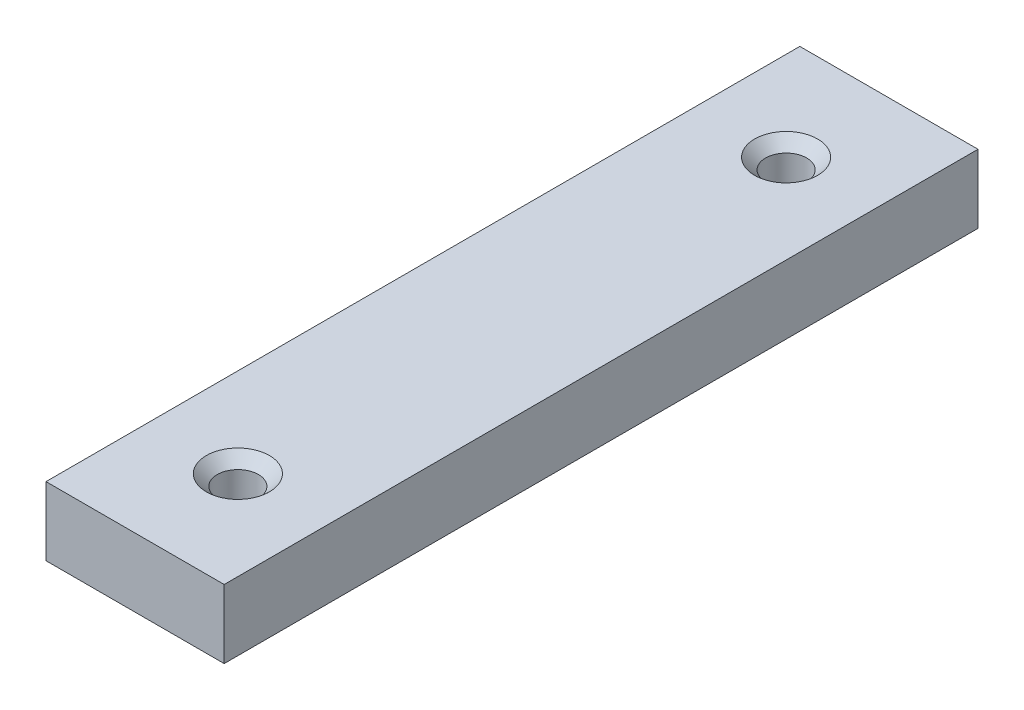
from build123d import *

# Parameters (mm, degrees)
SKETCH_2_W          = 26
SKETCH_2_H          = 110
EXTRUDE_1_DEPTH     = 5
CUT_EXTRUDE_1_REACH = 59.393
SKETCH_3_R          = 3
CHAMFER_1_SIZE      = 1.6


with BuildPart() as part:
    # Эскиз2 → Бобышка-Вытянуть1 (new, symmetric)
    with BuildSketch(Plane(origin=(0, 0, 0), x_dir=(1, 0, 0), z_dir=(0, 1, 0))):
        Rectangle(SKETCH_2_W, SKETCH_2_H)
    extrude(amount=EXTRUDE_1_DEPTH, both=True)

    # Эскиз3 → Вырез-Вытянуть1 (cut, up to next)
    with BuildSketch(Plane(origin=(0, 5, 0), x_dir=(1, 0, 0), z_dir=(0, 1, 0)), mode=Mode.PRIVATE) as cut_extrude_1_sk1:
        with Locations(Location((0, 40, 0), (0, 0, 270))):
            Circle(SKETCH_3_R)
    cut_extrude_1_tool1 = extrude(cut_extrude_1_sk1.sketch, amount=-CUT_EXTRUDE_1_REACH, mode=Mode.PRIVATE) & part.part
    # Эскиз3 → Вырез-Вытянуть1 (cut, up to next)
    with BuildSketch(Plane(origin=(0, 5, 0), x_dir=(1, 0, 0), z_dir=(0, 1, 0)), mode=Mode.PRIVATE) as cut_extrude_1_sk2:
        with Locations(Location((0, -40, 0), (0, 0, 270))):
            Circle(SKETCH_3_R)
    cut_extrude_1_tool2 = extrude(cut_extrude_1_sk2.sketch, amount=-CUT_EXTRUDE_1_REACH, mode=Mode.PRIVATE) & part.part
    add(cut_extrude_1_tool1.solids().sort_by_distance((0, 5, -40))[0], mode=Mode.SUBTRACT)
    add(cut_extrude_1_tool2.solids().sort_by_distance((0, 5, 40))[0], mode=Mode.SUBTRACT)

    # Фаска1
    chamfer_1_edges = [part.edges().sort_by_distance(p)[0] for p in [
        (0, 5, -43),
        (0, 5, 37),
    ]]
    chamfer(chamfer_1_edges, length=CHAMFER_1_SIZE)


solid = part.part
